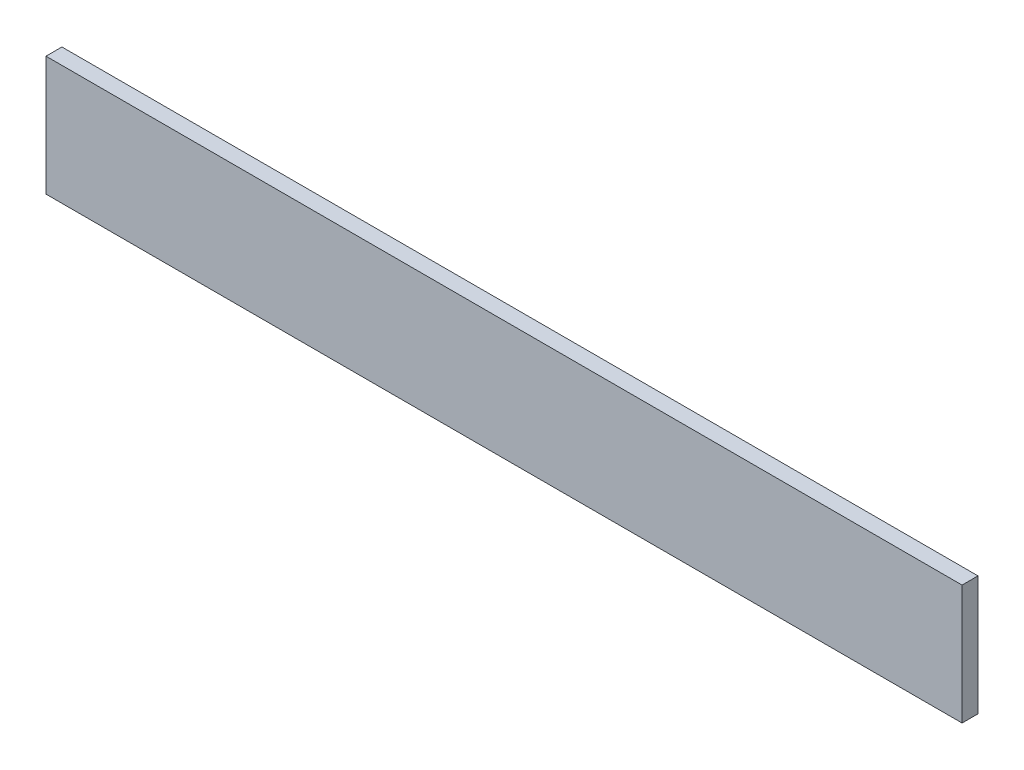
from build123d import *

# Parameters (mm, degrees)
SKETCH1_W           = 230
SKETCH1_H           = 30
BOSS_EXTRUDE1_DEPTH = 4


with BuildPart() as part:
    # Sketch1 → Boss-Extrude1 (new body)
    with BuildSketch(Plane.XY):
        with Locations((115, 15)):
            Rectangle(SKETCH1_W, SKETCH1_H)
    extrude(amount=BOSS_EXTRUDE1_DEPTH)


solid = part.part
